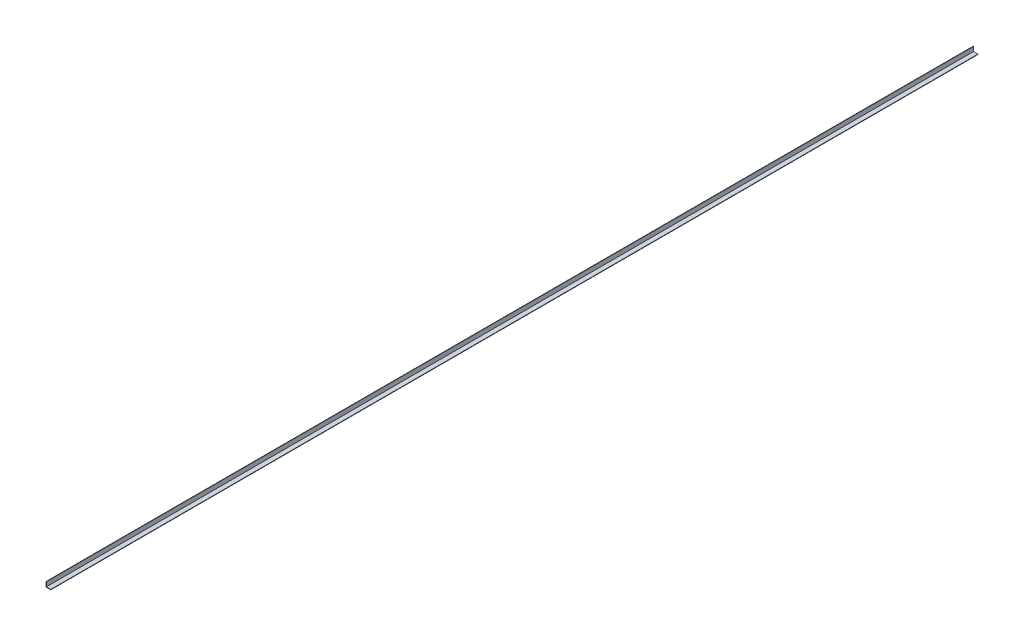
from build123d import *

# Parameters (mm, degrees)
SALIENTE_EXTRUIR1_DEPTH = 6100


with BuildPart() as part:
    # Croquis1 → Saliente-Extruir1 (new body)
    with BuildSketch(Plane.XY):
        Polygon((0, 31.75), (0, 0), (31.75, 0), (31.75, 2.7), (2.7, 2.7), (2.7, 31.75), align=None)
    extrude(amount=-SALIENTE_EXTRUIR1_DEPTH)


solid = part.part
